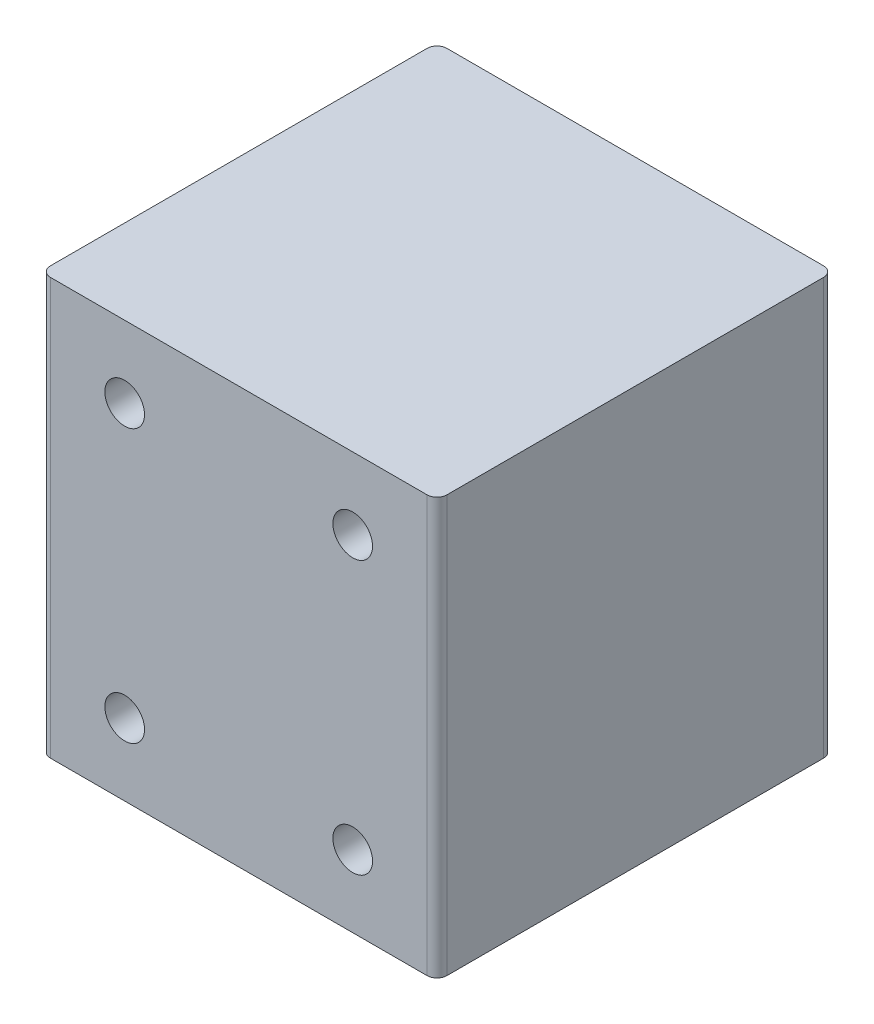
from build123d import *

# Parameters (mm, degrees)
SZKIC1_W                            = 80
SZKIC1_H                            = 80
DODANIE_WYCI_GNI_CIE1_DEPTH         = 84
OTWORY_USTALAJ_CE_8_0MM1_AT_2_COUNT = 2
OTWORY_USTALAJ_CE_8_0MM1_AT_2_PITCH = 46
OTWORY_USTALAJ_CE_8_0MM1_AT_3_COUNT = 2
OTWORY_USTALAJ_CE_8_0MM1_AT_3_PITCH = 71.700767081
OTWORY_USTALAJ_CE_8_0MM1_AT_4_COUNT = 2
OTWORY_USTALAJ_CE_8_0MM1_AT_4_PITCH = 55
ZAOKR_GLENIE2_R                     = 2


with BuildPart() as part:
    # Szkic1 → Dodanie-wyciągnięcie1 (new body)
    with BuildSketch(Plane(origin=(0, 0, 0), x_dir=(1, 0, 0), z_dir=(0, 1, 0))):
        Rectangle(SZKIC1_W, SZKIC1_H)
    extrude(amount=DODANIE_WYCI_GNI_CIE1_DEPTH)

    # Szkic4 → Otwory ustalające Ø8.0mm1 (revolve, cut)
    with BuildSketch(Plane(origin=(-23, 69.5, 40), x_dir=(0, -1, 0), z_dir=(1, 0, 0))):
        Polygon((0, 0), (0, 14.403442476), (4, 12), (4, 0), align=None)
    otwory_ustalaj_ce_8_0mm1 = revolve(axis=Axis((-23, 69.5, 46.35), (0, 0, -1)), mode=Mode.SUBTRACT)

    # Otwory ustalające Ø8.0mm1 at 2: Otwory ustalające Ø8.0mm1 ×2
    with Locations(*[(i * OTWORY_USTALAJ_CE_8_0MM1_AT_2_PITCH, 0, 0) for i in range(1, OTWORY_USTALAJ_CE_8_0MM1_AT_2_COUNT)]):
        add(otwory_ustalaj_ce_8_0mm1, mode=Mode.SUBTRACT)

    # Otwory ustalające Ø8.0mm1 at 3: Otwory ustalające Ø8.0mm1 ×2
    with Locations(*[Vector(0.6415552004911063, -0.7670768701524096, 0) * (i * OTWORY_USTALAJ_CE_8_0MM1_AT_3_PITCH) for i in range(1, OTWORY_USTALAJ_CE_8_0MM1_AT_3_COUNT)]):
        add(otwory_ustalaj_ce_8_0mm1, mode=Mode.SUBTRACT)

    # Otwory ustalające Ø8.0mm1 at 4: Otwory ustalające Ø8.0mm1 ×2
    with Locations(*[(0, -i * OTWORY_USTALAJ_CE_8_0MM1_AT_4_PITCH, 0) for i in range(1, OTWORY_USTALAJ_CE_8_0MM1_AT_4_COUNT)]):
        add(otwory_ustalaj_ce_8_0mm1, mode=Mode.SUBTRACT)

    # Lustro1: Otwory ustalające Ø8.0mm1 across plane
    add(otwory_ustalaj_ce_8_0mm1.mirror(Plane.XY), mode=Mode.SUBTRACT)

    # Lustro1 copy 1 sketch → Lustro1 copy 1 (revolve, cut)
    with BuildSketch(Plane(origin=(23, 69.5, -40), x_dir=(0, -1, 0), z_dir=(1, 0, 0))):
        Polygon((0, 0), (0, -14.403442476), (4, -12), (4, 0), align=None)
    revolve(axis=Axis((23, 69.5, -46.35), (0, 0, -1)), mode=Mode.SUBTRACT)

    # Lustro1 copy 2 sketch → Lustro1 copy 2 (revolve, cut)
    with BuildSketch(Plane(origin=(23, 14.5, -40), x_dir=(0, -1, 0), z_dir=(1, 0, 0))):
        Polygon((0, 0), (0, -14.403442476), (4, -12), (4, 0), align=None)
    revolve(axis=Axis((23, 14.5, -46.35), (0, 0, -1)), mode=Mode.SUBTRACT)

    # Lustro1 copy 3 sketch → Lustro1 copy 3 (revolve, cut)
    with BuildSketch(Plane(origin=(-23, 14.5, -40), x_dir=(0, -1, 0), z_dir=(1, 0, 0))):
        Polygon((0, 0), (0, -14.403442476), (4, -12), (4, 0), align=None)
    revolve(axis=Axis((-23, 14.5, -46.35), (0, 0, -1)), mode=Mode.SUBTRACT)

    # Zaokrąglenie2
    zaokr_glenie2_edges = [part.edges().sort_by_distance(p)[0] for p in [
        (40, 42, 40),
        (-40, 42, 40),
        (-40, 42, -40),
        (40, 42, -40),
    ]]
    fillet(zaokr_glenie2_edges, radius=ZAOKR_GLENIE2_R)


solid = part.part
